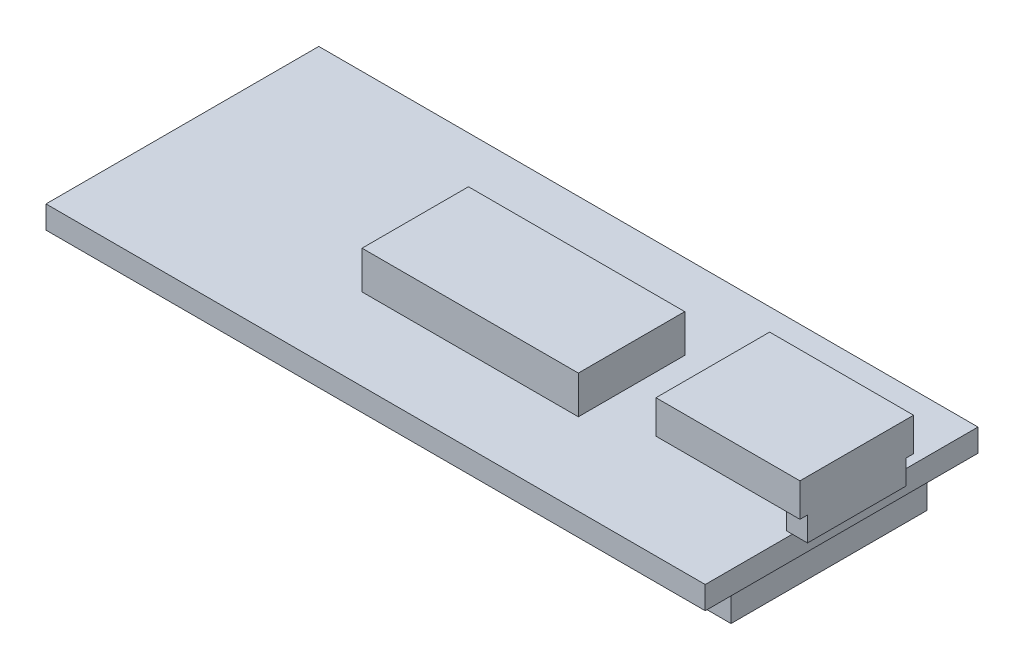
from build123d import *

# Parameters (mm, degrees)
SKETCH_1_W      = 43.5
SKETCH_1_H      = 18
EXTRUDE_1_DEPTH = 1.5
SKETCH_2_W      = 1.37636172
SKETCH_2_H      = 6.5
EXTRUDE_2_DEPTH = 3.8
SKETCH_3_W      = 9.5
SKETCH_3_H      = 7.5
EXTRUDE_7_DEPTH = 2.2
SKETCH_8_W      = 40.107603246
SKETCH_8_H      = 12.928280697
EXTRUDE_8_DEPTH = 2.5
SKETCH_9_W      = 14.27295549
SKETCH_9_H      = 7.021743376
EXTRUDE_9_DEPTH = 2.5


with BuildPart() as part:
    # Эскиз1 → Бобышка-Вытянуть1 (new body)
    with BuildSketch(Plane(origin=(0, 0, 0), x_dir=(1, 0, 0), z_dir=(0, 1, 0))):
        with Locations((21.75, 9)):
            Rectangle(SKETCH_1_W, SKETCH_1_H)
    extrude(amount=EXTRUDE_1_DEPTH)

    # Эскиз2 → Бобышка-Вытянуть2 (add)
    with BuildSketch(Plane(origin=(0, 1.5, 0), x_dir=(1, 0, 0), z_dir=(0, 1, 0))):
        with Locations((43.81181914, 9)):
            Rectangle(SKETCH_2_W, SKETCH_2_H)
    extrude(amount=EXTRUDE_2_DEPTH)

    # Эскиз3 → Бобышка-Вытянуть7 (add)
    with BuildSketch(Plane(origin=(0, 5.3, 0), x_dir=(1, 0, 0), z_dir=(0, 1, 0))):
        with Locations((39.75, 9)):
            Rectangle(SKETCH_3_W, SKETCH_3_H)
    extrude(amount=-EXTRUDE_7_DEPTH)

    # Эскиз8 → Бобышка-Вытянуть8 (add)
    with BuildSketch(Plane(origin=(0, 0, 0), x_dir=(-1, 0, 0), z_dir=(0, -1, 0))):
        with Locations((-22.53084927, 9.082336705)):
            Rectangle(SKETCH_8_W, SKETCH_8_H)
    extrude(amount=EXTRUDE_8_DEPTH)

    # Эскиз9 → Бобышка-Вытянуть9 (add)
    with BuildSketch(Plane(origin=(0, 1.5, 0), x_dir=(1, 0, 0), z_dir=(0, 1, 0))):
        with Locations((22.594203107, 8.908212505)):
            Rectangle(SKETCH_9_W, SKETCH_9_H)
    extrude(amount=EXTRUDE_9_DEPTH)


solid = part.part
